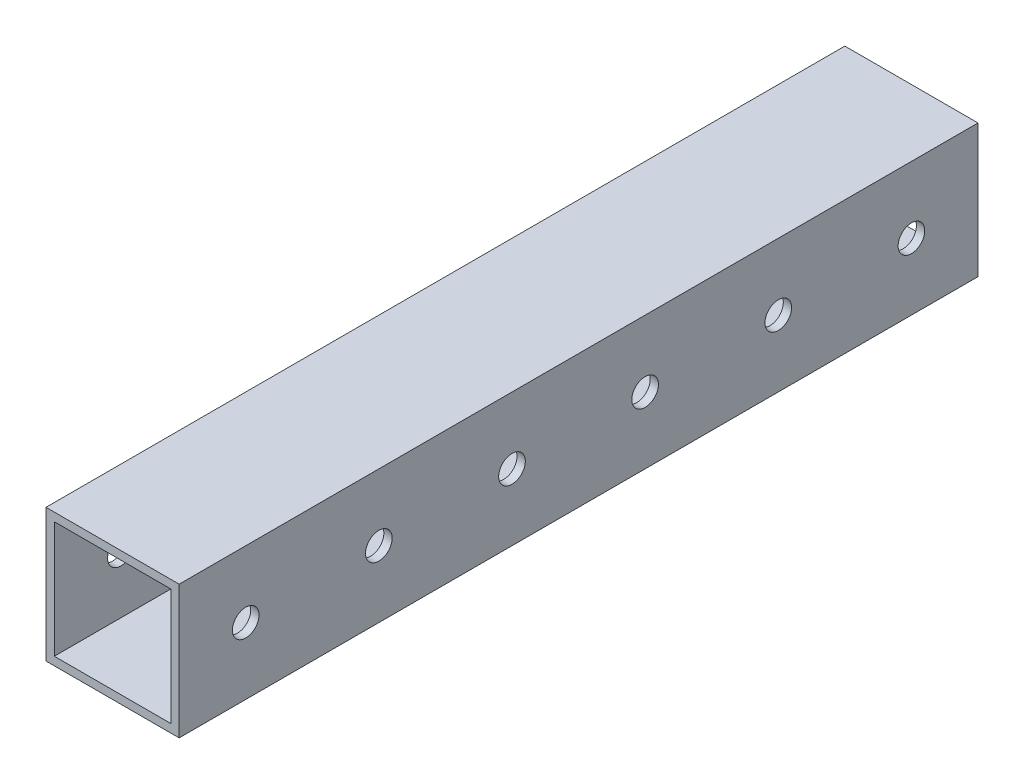
from build123d import *

# Parameters (mm, degrees)
SKETCH1_W           = 25.4
SKETCH1_H           = 25.4
SKETCH1_W_2         = 22.225
SKETCH1_H_2         = 22.225
BOSS_EXTRUDE1_DEPTH = 152.4
SKETCH4_R           = 2.54
CUT_EXTRUDE3_DEPTH  = 157.576115675


with BuildPart() as part:
    # Sketch1 → Boss-Extrude1 (new body)
    with BuildSketch(Plane.XY):
        with Locations((12.7, 12.7)):
            Rectangle(SKETCH1_W, SKETCH1_H)
        with Locations((12.7, 12.7)):
            Rectangle(SKETCH1_W_2, SKETCH1_H_2, mode=Mode.SUBTRACT)
    extrude(amount=BOSS_EXTRUDE1_DEPTH)

    # Sketch4 → Cut-Extrude3 (cut, through all)
    with BuildSketch(Plane(origin=(25.4, 0, 0), x_dir=(0, 0, -1), z_dir=(1, 0, 0))):
        with Locations((-139.7, 12.7)):
            Circle(SKETCH4_R)
        with Locations((-114.3, 12.7)):
            Circle(SKETCH4_R)
        with Locations((-88.9, 12.7)):
            Circle(SKETCH4_R)
        with Locations(Location((-63.5, 12.7, 0), (0, 0, 180))):
            Circle(SKETCH4_R)
        with Locations(Location((-38.1, 12.7, 0), (0, 0, 180))):
            Circle(SKETCH4_R)
        with Locations(Location((-12.7, 12.7, 0), (0, 0, 180))):
            Circle(SKETCH4_R)
    extrude(amount=-CUT_EXTRUDE3_DEPTH, mode=Mode.SUBTRACT)


solid = part.part
